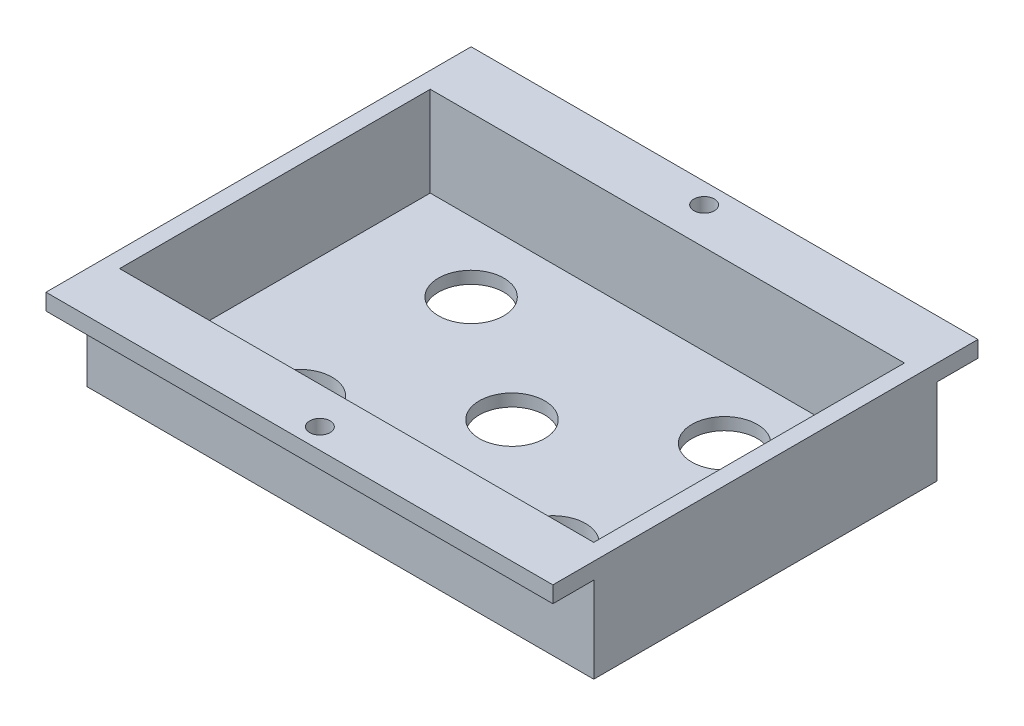
from build123d import *

# Parameters (mm, degrees)
SKETCH1_W           = 124
SKETCH1_H           = 84
BOSS_EXTRUDE1_DEPTH = 25
SKETCH2_W           = 116
SKETCH2_H           = 76
CUT_EXTRUDE1_DEPTH  = 22
SKETCH3_R           = 8
CUT_EXTRUDE2_DEPTH  = 79.051265204
SKETCH4_W           = 124
SKETCH4_H           = 4
BOSS_EXTRUDE2_DEPTH = 10
SKETCH5_W           = 124
SKETCH5_H           = 4
BOSS_EXTRUDE3_DEPTH = 10
SKETCH6_R           = 2.5
CUT_EXTRUDE3_DEPTH  = 85.693565281


with BuildPart() as part:
    # Sketch1 → Boss-Extrude1 (new body)
    with BuildSketch(Plane(origin=(0, 0, 0), x_dir=(1, 0, 0), z_dir=(0, 1, 0))):
        Rectangle(SKETCH1_W, SKETCH1_H)
    extrude(amount=BOSS_EXTRUDE1_DEPTH)

    # Sketch2 → Cut-Extrude1 (cut)
    with BuildSketch(Plane(origin=(0, 25, 0), x_dir=(1, 0, 0), z_dir=(0, 1, 0))):
        Rectangle(SKETCH2_W, SKETCH2_H)
    extrude(amount=-CUT_EXTRUDE1_DEPTH, mode=Mode.SUBTRACT)

    # Sketch3 → Cut-Extrude2 (cut, through all)
    with BuildSketch(Plane(origin=(0, 3, 0), x_dir=(1, 0, 0), z_dir=(0, 1, 0))):
        with Locations(Location((0, 0, 0), (0, 0, 270))):
            Circle(SKETCH3_R)
        with Locations(Location((-31, 21, 0), (0, 0, 270))):
            Circle(SKETCH3_R)
        with Locations(Location((-31, -21, 0), (0, 0, 270))):
            Circle(SKETCH3_R)
        with Locations(Location((31, 21, 0), (0, 0, 270))):
            Circle(SKETCH3_R)
        with Locations(Location((31, -21, 0), (0, 0, 270))):
            Circle(SKETCH3_R)
    extrude(amount=-CUT_EXTRUDE2_DEPTH, mode=Mode.SUBTRACT)

    # Sketch4 → Boss-Extrude2 (add)
    with BuildSketch(Plane.XY.offset(42)):
        with Locations((0, 23)):
            Rectangle(SKETCH4_W, SKETCH4_H)
    extrude(amount=BOSS_EXTRUDE2_DEPTH)

    # Sketch5 → Boss-Extrude3 (add)
    with BuildSketch(Plane(origin=(0, 0, -42), x_dir=(-1, 0, 0), z_dir=(0, 0, -1))):
        with Locations((0, 23)):
            Rectangle(SKETCH5_W, SKETCH5_H)
    extrude(amount=BOSS_EXTRUDE3_DEPTH)

    # Sketch6 → Cut-Extrude3 (cut, through all)
    with BuildSketch(Plane(origin=(0, 25, 0), x_dir=(1, 0, 0), z_dir=(0, 1, 0))):
        with Locations(Location((0, 47, 0), (0, 0, 270))):
            Circle(SKETCH6_R)
        with Locations(Location((0, -47, 0), (0, 0, 270))):
            Circle(SKETCH6_R)
    extrude(amount=-CUT_EXTRUDE3_DEPTH, mode=Mode.SUBTRACT)


solid = part.part
